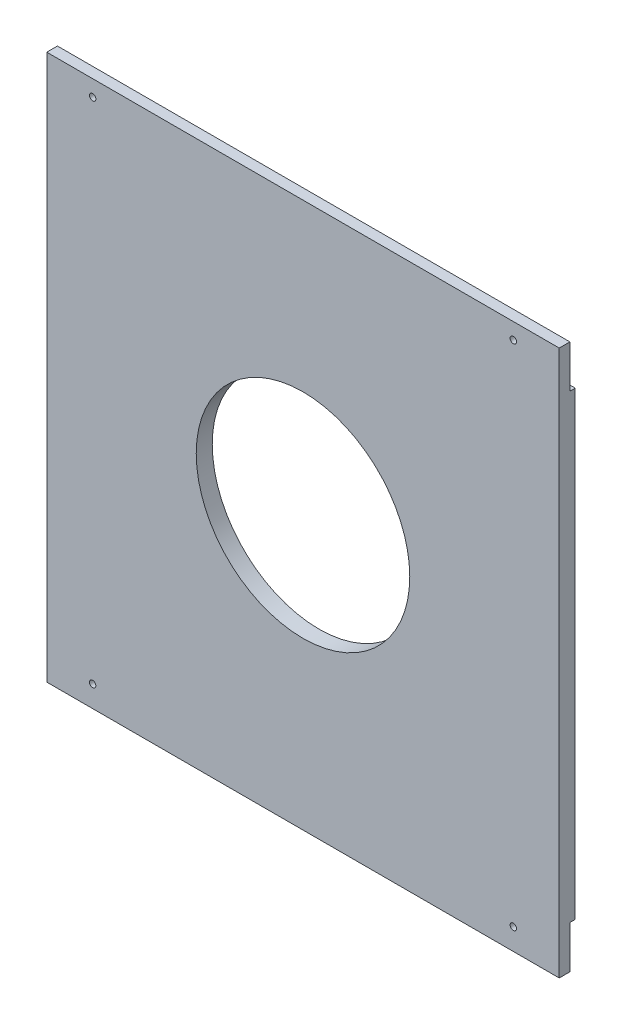
from build123d import *

# Parameters (mm, degrees)
SKETCH1_W           = 480
SKETCH1_H           = 511
SKETCH1_R           = 3
BOSS_EXTRUDE1_DEPTH = 15
SKETCH2_W           = 40
SKETCH2_H           = 40
SKETCH2_H_2         = 431
SKETCH2_W_2         = 440
CUT_EXTRUDE1_DEPTH  = 5
SKETCH3_R           = 100
CUT_EXTRUDE2_DEPTH  = 15
SKETCH4_R           = 1.5
CUT_EXTRUDE3_DEPTH  = 7
CUT_EXTRUDE4_DEPTH  = 2.3
SKETCH6_R           = 3
CUT_EXTRUDE5_DEPTH  = 7
SKETCH7_R           = 1.5
CUT_EXTRUDE6_DEPTH  = 5


with BuildPart() as part:
    # Sketch1 → Boss-Extrude1 (new body)
    with BuildSketch(Plane.XY):
        Rectangle(SKETCH1_W, SKETCH1_H)
        with Locations((-197, 240.5)):
            Circle(SKETCH1_R, mode=Mode.SUBTRACT)
        with Locations((-197, -235.5)):
            Circle(SKETCH1_R, mode=Mode.SUBTRACT)
        with Locations(Location((197, -235.5, 0), (0, 0, 180))):
            Circle(SKETCH1_R, mode=Mode.SUBTRACT)
        with Locations(Location((197, 240.5, 0), (0, 0, 180))):
            Circle(SKETCH1_R, mode=Mode.SUBTRACT)
    extrude(amount=BOSS_EXTRUDE1_DEPTH)

    # Sketch2 → Cut-Extrude1 (cut)
    with BuildSketch(Plane(origin=(0, 0, 0), x_dir=(-1, 0, 0), z_dir=(0, 0, -1))):
        Polygon((-200, 255.5), (-240, 255.5), (-240, 215.5), (200, 215.5), (200, 255.5), align=None)
        with Locations((220, 235.5)):
            Rectangle(SKETCH2_W, SKETCH2_H)
        with Locations((220, 0)):
            Rectangle(SKETCH2_W, SKETCH2_H_2)
        with Locations((-20, -235.5)):
            Rectangle(SKETCH2_W_2, SKETCH2_H)
        with Locations((220, -235.5)):
            Rectangle(SKETCH2_W, SKETCH2_H)
    extrude(amount=-CUT_EXTRUDE1_DEPTH, mode=Mode.SUBTRACT)

    # Sketch3 → Cut-Extrude2 (cut)
    with BuildSketch(Plane(origin=(0, 0, 0), x_dir=(-1, 0, 0), z_dir=(0, 0, -1))):
        Circle(SKETCH3_R)
    extrude(amount=-CUT_EXTRUDE2_DEPTH, mode=Mode.SUBTRACT)

    # Sketch4 → Cut-Extrude3 (cut)
    with BuildSketch(Plane(origin=(0, 0, 0), x_dir=(-1, 0, 0), z_dir=(0, 0, -1))):
        with Locations((22.80945209, 173.254989525)):
            Circle(SKETCH4_R)
        with Locations(Location((-22.80945209, 173.254989525, 0), (0, 0, 180))):
            Circle(SKETCH4_R)
        with Locations((-161.447948306, -66.873929806)):
            Circle(SKETCH4_R)
        with Locations(Location((-138.638496216, -106.381059719, 0), (0, 0, 180))):
            Circle(SKETCH4_R)
        with Locations((138.638496216, -106.381059719)):
            Circle(SKETCH4_R)
        with Locations(Location((161.447948306, -66.873929806, 0), (0, 0, 180))):
            Circle(SKETCH4_R)
    extrude(amount=-CUT_EXTRUDE3_DEPTH, mode=Mode.SUBTRACT)

    # Sketch5 → Cut-Extrude4 (cut)
    with BuildSketch(Plane(origin=(0, 0, 0), x_dir=(-1, 0, 0), z_dir=(0, 0, -1))):
        Polygon((22.80945209, 176.430416006), (20.05945209, 174.842702765), (20.05945209, 171.667276285), (22.80945209, 170.079563045), (25.55945209, 171.667276285), (25.55945209, 174.842702765), align=None)
        Polygon((-20.05945209, 174.842702765), (-20.05945209, 171.667276285), (-22.80945209, 170.079563045), (-25.55945209, 171.667276285), (-25.55945209, 174.842702765), (-22.80945209, 176.430416006), align=None)
        Polygon((-164.197948306, -68.461643046), (-161.447948306, -70.049356286), (-158.697948306, -68.461643046), (-158.697948306, -65.286216566), (-161.447948306, -63.698503325), (-164.197948306, -65.286216566), align=None)
        Polygon((-138.638496216, -109.5564862), (-141.388496216, -107.96877296), (-141.388496216, -104.793346479), (-138.638496216, -103.205633239), (-135.888496216, -104.793346479), (-135.888496216, -107.96877296), align=None)
        Polygon((141.388496216, -107.96877296), (141.388496216, -104.793346479), (138.638496216, -103.205633239), (135.888496216, -104.793346479), (135.888496216, -107.96877296), (138.638496216, -109.5564862), align=None)
        Polygon((164.197948306, -65.286216566), (164.197948306, -68.461643046), (161.447948306, -70.049356286), (158.697948306, -68.461643046), (158.697948306, -65.286216566), (161.447948306, -63.698503325), align=None)
    extrude(amount=-CUT_EXTRUDE4_DEPTH, mode=Mode.SUBTRACT)

    # Sketch6 → Cut-Extrude5 (cut)
    with BuildSketch(Plane(origin=(0, 0, 0), x_dir=(-1, 0, 0), z_dir=(0, 0, -1))):
        with Locations((-156.911542489, 135.010250847)):
            Circle(SKETCH6_R)
    extrude(amount=-CUT_EXTRUDE5_DEPTH, mode=Mode.SUBTRACT)

    # Sketch7 → Cut-Extrude6 (cut)
    with BuildSketch(Plane(origin=(0, 0, 0), x_dir=(-1, 0, 0), z_dir=(0, 0, -1))):
        with Locations((-123.323970382, 168.597822953)):
            Circle(SKETCH7_R)
        with Locations((-190.499114595, 168.597822953)):
            Circle(SKETCH7_R)
        with Locations((-190.499114595, 101.422678741)):
            Circle(SKETCH7_R)
    extrude(amount=-CUT_EXTRUDE6_DEPTH, mode=Mode.SUBTRACT)


solid = part.part
